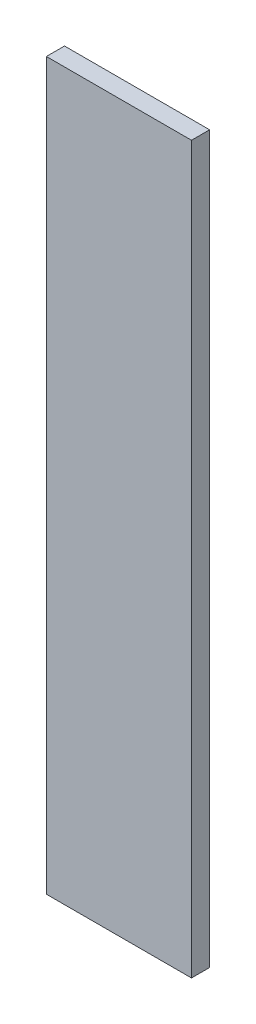
from build123d import *

# Parameters (mm, degrees)
ESQUISSE1_W        = 50.8
ESQUISSE1_H        = 254
BOSS_EXTRU_1_DEPTH = 6.35


with BuildPart() as part:
    # Esquisse1 → Boss.-Extru.1 (new body)
    with BuildSketch(Plane.XY):
        Rectangle(ESQUISSE1_W, ESQUISSE1_H)
    extrude(amount=BOSS_EXTRU_1_DEPTH)


solid = part.part
